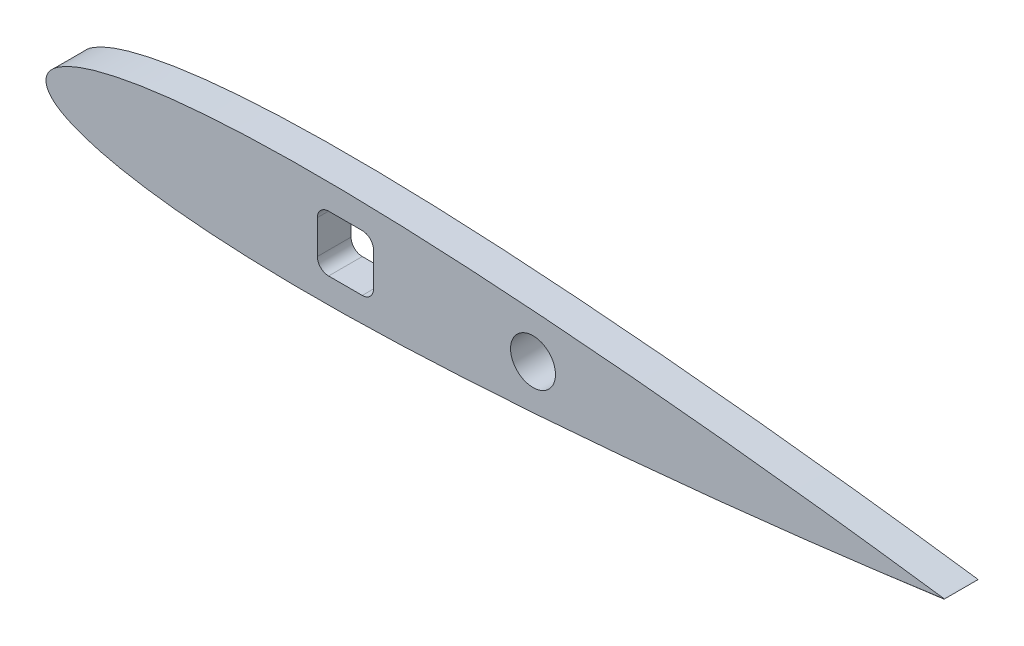
from build123d import *

# Parameters (mm, degrees)
RESSALTO_EXTRUS_O1_DEPTH = 6
CORTE_EXTRUS_O1_DEPTH    = 161.395073036
CORTE_EXTRUS_O2_DEPTH    = 2
ESBO_O1_10_R             = 4
CORTE_EXTRUS_O4_DEPTH    = 10


with BuildPart() as part:
    # Esboço1 → Ressalto-extrusão1 (new body)
    with BuildSketch(Plane.XY):
        with BuildLine():
            add(Edge.make_bspline(
                [(160, 0), (160, 0.066591344), (159.008486515, 0.137516413), (158.42440387, 0.221471317), (158.144338748, 0.260261488), (157.684388421, 0.324769541), (157.039126305, 0.414505738), (156.21318624, 0.528445909), (155.207288702, 0.666731734), (154.024156074, 0.82786753), (152.666421822, 1.010809688), (151.137358572, 1.214775844), (149.440501634, 1.438301657), (147.579810673, 1.680337187), (145.559591027, 1.938939616), (143.3845941, 2.213454958), (141.059883391, 2.501962633), (138.590909577, 2.802970442), (135.983457145, 3.115134759), (133.243598367, 3.436824452), (130.377631627, 3.766112447), (127.392413596, 4.102157796), (124.294822673, 4.442549865), (121.092191644, 4.786374443), (117.791874953, 5.131174486), (114.401652067, 5.476311054), (110.929399348, 5.819122724), (107.383281016, 6.158532862), (103.771531838, 6.492184079), (100.102577128, 6.818985552), (96.385008348, 7.136235671), (92.627488908, 7.442515398), (88.83884216, 7.735868786), (85.027868318, 8.01394094), (81.20352334, 8.27498782), (77.374734608, 8.516924223), (73.550364568, 8.737413611), (69.739416102, 8.934712342), (65.950702839, 9.106666477), (62.193104455, 9.25136047), (58.475453138, 9.367187945), (54.806404369, 9.452088579), (51.194523839, 9.504565656), (47.648159341, 9.523144227), (44.175663125, 9.506720322), (40.785162133, 9.454555515), (37.484601399, 9.365073334), (34.281615949, 9.238669757), (31.18367953, 9.074436542), (28.198004535, 8.872834015), (25.331621548, 8.633904207), (22.591194744, 8.358081382), (19.983091588, 8.046411859), (17.513324782, 7.700162492), (15.187712508, 7.319978719), (13.01158463, 6.907760635), (10.989949471, 6.465058244), (9.127531756, 5.993372262), (7.428446848, 5.494815761), (5.896441226, 4.971044452), (4.534781976, 4.423867317), (3.346164565, 3.854862866), (2.332853463, 3.265215735), (1.496028631, 2.655925492), (0.837307039, 2.02598989), (0.358277212, 1.373624426), (0.065397623, 0.695640412), (-0.03187754, 0), (0.065397623, -0.695640412), (0.358277212, -1.373624426), (0.837307039, -2.02598989), (1.496028631, -2.655925492), (2.332853463, -3.265215735), (3.346164565, -3.854862866), (4.534781976, -4.423867317), (5.896441226, -4.971044452), (7.428446848, -5.494815761), (9.127531756, -5.993372262), (10.989949471, -6.465058244), (13.01158463, -6.907760635), (15.187712508, -7.319978719), (17.513324782, -7.700162492), (19.983091588, -8.046411859), (22.591194744, -8.358081382), (25.331621548, -8.633904207), (28.198004535, -8.872834015), (31.18367953, -9.074436542), (34.281615949, -9.238669757), (37.484601399, -9.365073334), (40.785162133, -9.454555515), (44.175663125, -9.506720322), (47.648159341, -9.523144227), (51.194523839, -9.504565656), (54.806404369, -9.452088579), (58.475453138, -9.367187945), (62.193104455, -9.25136047), (65.950702839, -9.106666477), (69.739416102, -8.934712342), (73.550364568, -8.737413611), (77.374734608, -8.516924223), (81.20352334, -8.27498782), (85.027868318, -8.01394094), (88.83884216, -7.735868786), (92.627488908, -7.442515398), (96.385008348, -7.136235671), (100.102577128, -6.818985552), (103.771531838, -6.492184079), (107.383281016, -6.158532862), (110.929399348, -5.819122724), (114.401652067, -5.476311054), (117.791874953, -5.131174486), (121.092191644, -4.786374443), (124.294822673, -4.442549865), (127.392413596, -4.102157796), (130.377631627, -3.766112447), (133.243598367, -3.436824452), (135.983457145, -3.115134759), (138.590909577, -2.802970442), (141.059883391, -2.501962633), (143.3845941, -2.213454958), (145.559591027, -1.938939616), (147.579810673, -1.680337187), (149.440501634, -1.438301657), (151.137358572, -1.214775844), (152.666421822, -1.010809688), (154.024156074, -0.82786753), (155.207288702, -0.666731734), (156.21318624, -0.528445909), (157.039126305, -0.414505738), (157.684388421, -0.324769541), (158.144338748, -0.260261488), (158.42440387, -0.221471317), (159.008486515, -0.137516413), (160, -0.066591344), (160, 0)],
                knots=[0, 0, 0, 0, 0.004404679, 0.004691333, 0.005550263, 0.00697996, 0.00897637, 0.011534826, 0.01464942, 0.018312468, 0.02251533, 0.027247507, 0.032497897, 0.038253958, 0.044502067, 0.051226869, 0.058413314, 0.066043467, 0.074098984, 0.082561952, 0.091411519, 0.100627009, 0.110186575, 0.120067575, 0.130246743, 0.140700546, 0.151404252, 0.162331842, 0.173458675, 0.18475829, 0.196204076, 0.207768618, 0.219425945, 0.231147635, 0.242906359, 0.254675296, 0.26642621, 0.278132455, 0.289766477, 0.301301814, 0.312711646, 0.323969259, 0.33505005, 0.345928599, 0.356580621, 0.366981996, 0.377109776, 0.386942119, 0.396457905, 0.405636645, 0.41445907, 0.42290662, 0.430962851, 0.438611618, 0.445838275, 0.452630377, 0.458976173, 0.4648663, 0.470293868, 0.475254829, 0.479749124, 0.483781006, 0.48736258, 0.490515632, 0.493278566, 0.495712194, 0.497909944, 0.5, 0.502090056, 0.504287806, 0.506721434, 0.509484368, 0.51263742, 0.516218994, 0.520250876, 0.524745171, 0.529706132, 0.5351337, 0.541023827, 0.547369623, 0.554161725, 0.561388382, 0.569037149, 0.57709338, 0.58554093, 0.594363355, 0.603542095, 0.613057881, 0.622890224, 0.633018004, 0.643419379, 0.654071401, 0.66494995, 0.676030741, 0.687288354, 0.698698186, 0.710233523, 0.721867545, 0.73357379, 0.745324704, 0.757093641, 0.768852365, 0.780574055, 0.792231382, 0.803795924, 0.81524171, 0.826541325, 0.837668158, 0.848595748, 0.859299454, 0.869753257, 0.879932425, 0.889813425, 0.899372991, 0.908588481, 0.917438048, 0.925901016, 0.933956533, 0.941586686, 0.948773131, 0.955497933, 0.961746042, 0.967502103, 0.972752493, 0.97748467, 0.981687532, 0.98535058, 0.988465174, 0.99102363, 0.99302004, 0.994449737, 0.995308667, 0.995595321, 1, 1, 1, 1], degree=3))
        make_face()
    extrude(amount=RESSALTO_EXTRUS_O1_DEPTH)

    # Esboço1<5> → Corte-extrusão1 (cut, through all)
    with BuildSketch(Plane.XY):
        with BuildLine():
            Line((56.33333333, -5), (50.33333333, -5))
            ThreePointArc((50.33333333, -5), (48.919119768, -4.414213562), (48.33333333, -3))
            Line((48.33333333, -3), (48.33333333, 3))
            ThreePointArc((48.33333333, 3), (48.919119768, 4.414213562), (50.33333333, 5))
            Line((50.33333333, 5), (56.33333333, 5))
            ThreePointArc((56.33333333, 5), (57.747546892, 4.414213562), (58.33333333, 3))
            Line((58.33333333, 3), (58.33333333, -3))
            ThreePointArc((58.33333333, -3), (57.747546892, -4.414213562), (56.33333333, -5))
        make_face()
    extrude(amount=CORTE_EXTRUS_O1_DEPTH, mode=Mode.SUBTRACT)

    # Esboço1<6> → Corte-extrusão2 (cut)
    with BuildSketch(Plane.XY):
        with BuildLine():
            Line((13, -4), (17, -4))
            ThreePointArc((17, -4), (18.414213562, -3.414213562), (19, -2))
            Line((19, -2), (19, 2))
            ThreePointArc((19, 2), (18.414213562, 3.414213562), (17, 4))
            Line((17, 4), (13, 4))
            ThreePointArc((13, 4), (11.585786438, 3.414213562), (11, 2))
            Line((11, 2), (11, -2))
            ThreePointArc((11, -2), (11.585786438, -3.414213562), (13, -4))
        make_face()
    extrude(amount=CORTE_EXTRUS_O2_DEPTH, mode=Mode.SUBTRACT)

    # Esboço1<10> → Corte-extrusão4 (cut)
    with BuildSketch(Plane.XY):
        with Locations((86.745233987, 0)):
            Circle(ESBO_O1_10_R)
    extrude(amount=CORTE_EXTRUS_O4_DEPTH, mode=Mode.SUBTRACT)


solid = part.part
